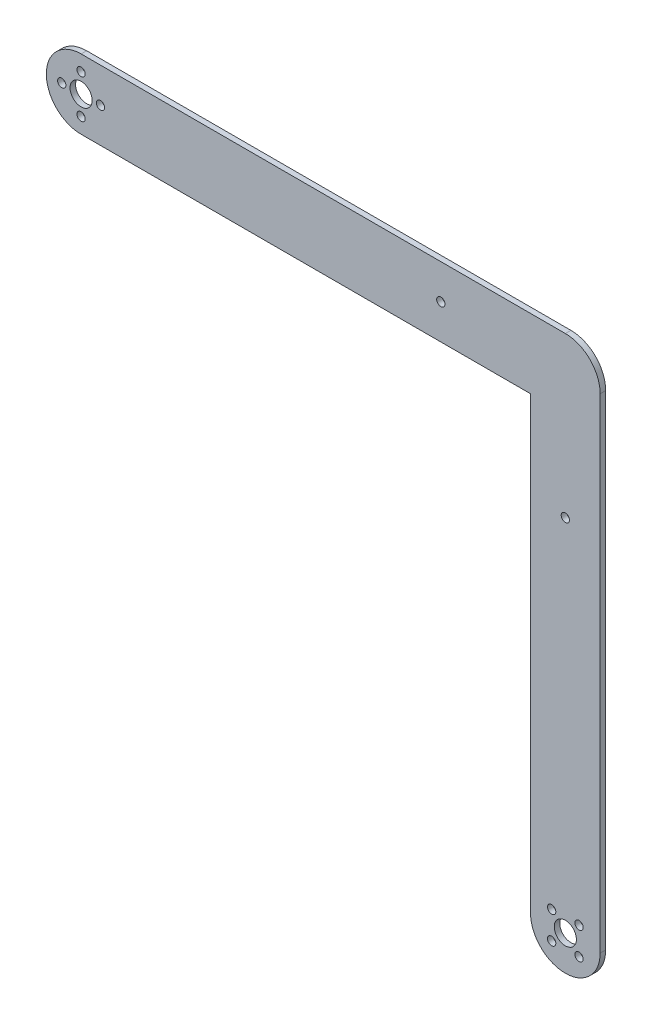
from build123d import *

# Parameters (mm, degrees)
SKETCH_1_R      = 4
SKETCH_1_R_2    = 1.5
EXTRUDE_2_DEPTH = 2


with BuildPart() as part:
    # 草图1 → 凸台-拉伸2 (new body)
    with BuildSketch(Plane.XY):
        with BuildLine():
            Line((-12.585683816, 0), (-12.585683816, 162.5))
            Line((-12.585683816, 162.5), (-175, 162.5))
            ThreePointArc((-175, 162.5), (-187.573970324, 175.073970324), (-175, 187.647940648))
            Line((-175, 187.647940648), (0.011713493, 187.647940648))
            ThreePointArc((0.011713493, 187.647940648), (8.902853175, 183.965110006), (12.585683816, 175.073970324))
            Line((12.585683816, 175.073970324), (12.585683816, 0))
            ThreePointArc((12.585683816, 0), (0, -12.585683816), (-12.585683816, 0))
        make_face()
        Circle(SKETCH_1_R, mode=Mode.SUBTRACT)
        with Locations((-175, 175.073970324)):
            Circle(SKETCH_1_R, mode=Mode.SUBTRACT)
        with Locations((-175, 182.073970324)):
            Circle(SKETCH_1_R_2, mode=Mode.SUBTRACT)
        with Locations((-168, 175.073970324)):
            Circle(SKETCH_1_R_2, mode=Mode.SUBTRACT)
        with Locations((-175, 168.073970324)):
            Circle(SKETCH_1_R_2, mode=Mode.SUBTRACT)
        with Locations((-182, 175.073970324)):
            Circle(SKETCH_1_R_2, mode=Mode.SUBTRACT)
        with Locations((0, 130)):
            Circle(SKETCH_1_R_2, mode=Mode.SUBTRACT)
        with Locations((-45, 175.073970324)):
            Circle(SKETCH_1_R_2, mode=Mode.SUBTRACT)
        with Locations((4.949747468, 4.949747468)):
            Circle(SKETCH_1_R_2, mode=Mode.SUBTRACT)
        with Locations((4.949747468, -4.949747468)):
            Circle(SKETCH_1_R_2, mode=Mode.SUBTRACT)
        with Locations((-4.949747468, -4.949747468)):
            Circle(SKETCH_1_R_2, mode=Mode.SUBTRACT)
        with Locations((-4.949747468, 4.949747468)):
            Circle(SKETCH_1_R_2, mode=Mode.SUBTRACT)
    extrude(amount=EXTRUDE_2_DEPTH)


solid = part.part
